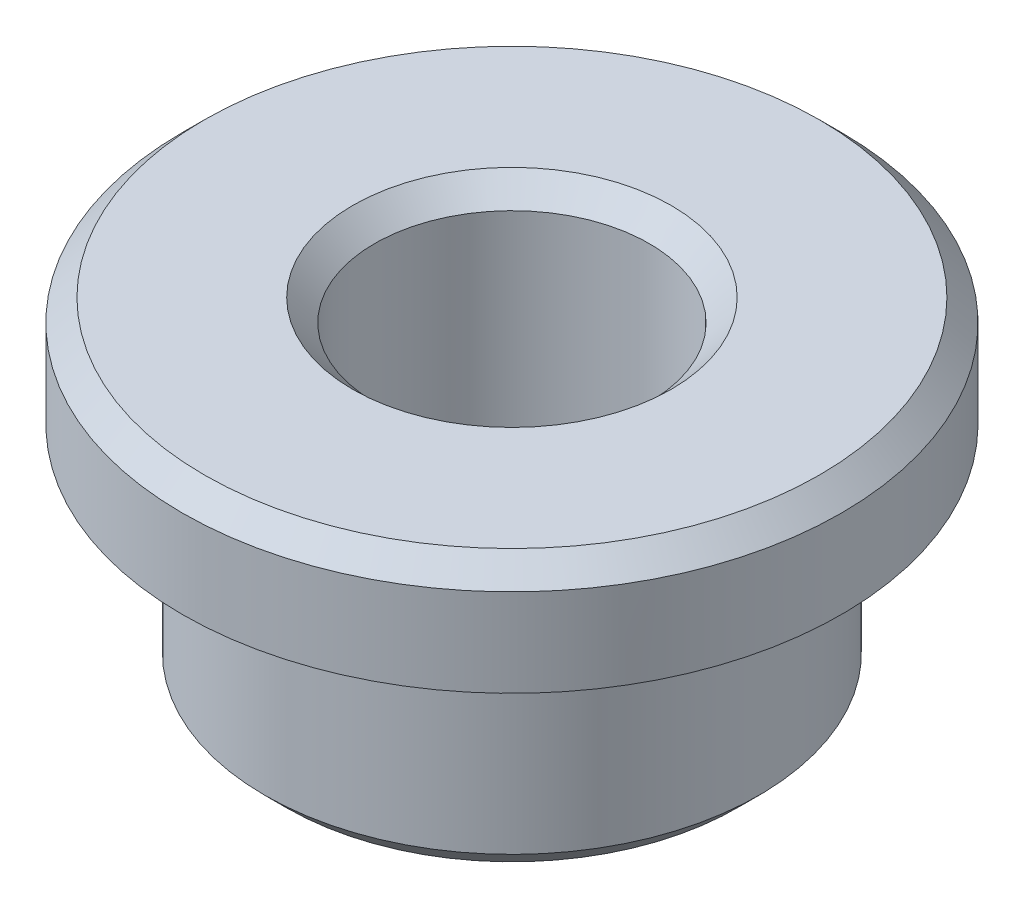
from build123d import *

# Parameters (mm, degrees)
CHAMFER1_SIZE = 0.2


with BuildPart() as part:
    # Sketch1 → Revolve1 (revolve)
    with BuildSketch(Plane(origin=(0, 0, 0), x_dir=(0, 0, -1), z_dir=(1, 0, 0)), mode=Mode.PRIVATE) as revolve1_sk:
        Polygon((1.25, 3), (1.25, 0), (2.25, 0), (2.25, 2), (3, 2), (3, 3), align=None)
    revolve(revolve1_sk.sketch.rotate(Axis((0, 6.791174038, 0), (0, -1, 0)), 180), axis=Axis((0, 6.791174038, 0), (0, -1, 0)))

    # Chamfer1
    chamfer1_edges = [part.edges().sort_by_distance(p)[0] for p in [
        (0, 3, -1.25),
        (0, 3, -3),
        (0, 0, -2.25),
    ]]
    chamfer(chamfer1_edges, length=CHAMFER1_SIZE)


solid = part.part
